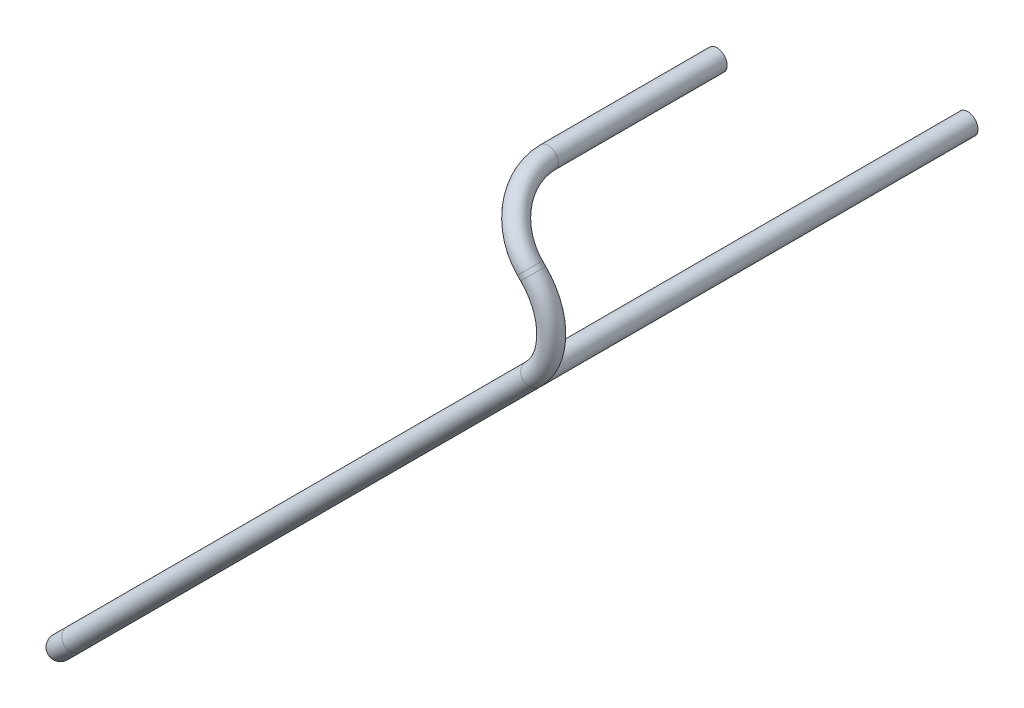
from build123d import *

# Parameters (mm, degrees)
PIPESKETCH_R   = 6.35
PIPESKETCH_R_2 = 5.1054


with BuildPart() as part:
    # ThinSweep: sweep along a curve in space
    with BuildLine() as thinsweep_path:
        Line((0, 0, 0), (0, 0, 541.779553996))
        ThreePointArc((0, 0, 541.779553996), (7.890768363, 7.890768363, 568.72032236), (26.940768363, 26.940768363, 579.879553996))
        Line((26.940768363, 26.940768363, 579.879553996), (310.977472549, 310.977472549, 579.879553996))
        ThreePointArc((310.977472549, 310.977472549, 579.879553996), (322.136704186, 337.918240913, 579.879553996), (310.977472549, 364.859009276, 579.879553996))
        Line((310.977472549, 364.859009276, 579.879553996), (308.951639669, 366.884842156, 579.879553996))
        ThreePointArc((308.951639669, 366.884842156, 579.879553996), (289.901639669, 385.934842156, 568.72032236), (282.010871306, 393.825610519, 541.779553996))
        Line((282.010871306, 393.825610519, 437.228053913), (282.010871306, 393.825610519, 541.779553996))
    # PipeSketch → ThinSweep (sweep)
    with BuildSketch(Plane.XY):
        Circle(PIPESKETCH_R)
        Circle(PIPESKETCH_R_2, mode=Mode.SUBTRACT)
    sweep(path=thinsweep_path.line)


solid = part.part
